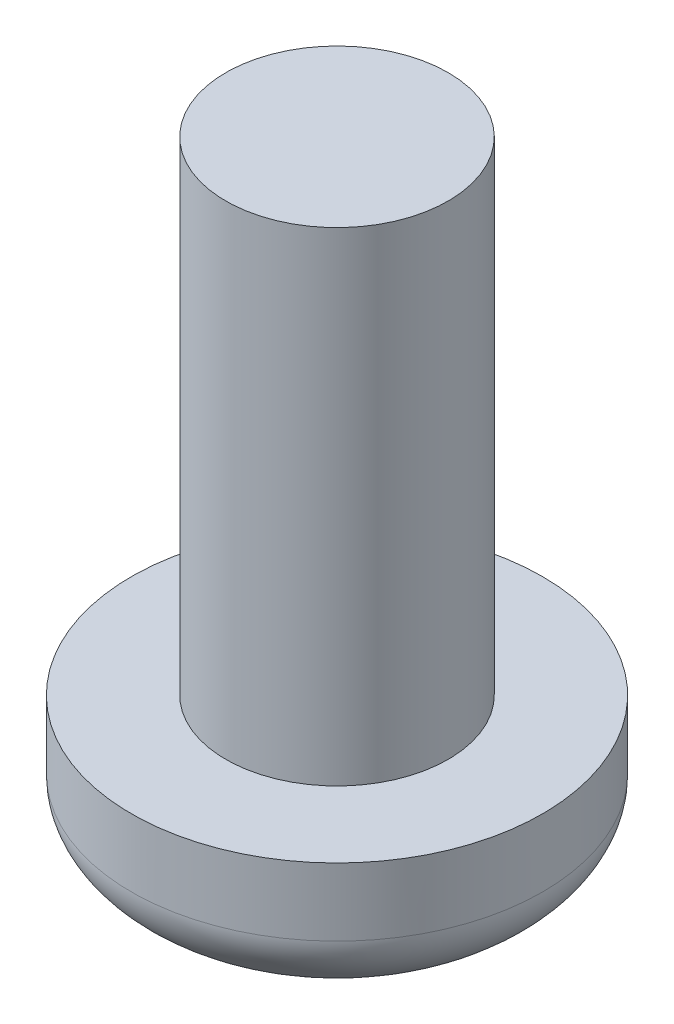
from build123d import *


with BuildPart() as part:
    # Sketch1 → Revolve1 (revolve)
    with BuildSketch(Plane.XY, mode=Mode.PRIVATE) as revolve1_sk:
        with BuildLine():
            Line((0, -3.5), (0, 10))
            Line((0, 10), (2.3, 10))
            Line((2.3, 10), (2.3, 0))
            Line((2.3, 0), (4.25, 0))
            Line((4.25, 0), (4.25, -1.4))
            add(Edge.make_bspline(
                [(0, -3.5), (4.25, -3.5), (4.25, -1.4)],
                knots=[4.71238898, 4.71238898, 4.71238898, 6.283185307, 6.283185307, 6.283185307], degree=2, weights=[1, 0.707106781, 1]))
        make_face()
    revolve(revolve1_sk.sketch.rotate(Axis((0, -1.134846462, 0), (0, 1, 0)), 90), axis=Axis((0, -1.134846462, 0), (0, 1, 0)))


solid = part.part
